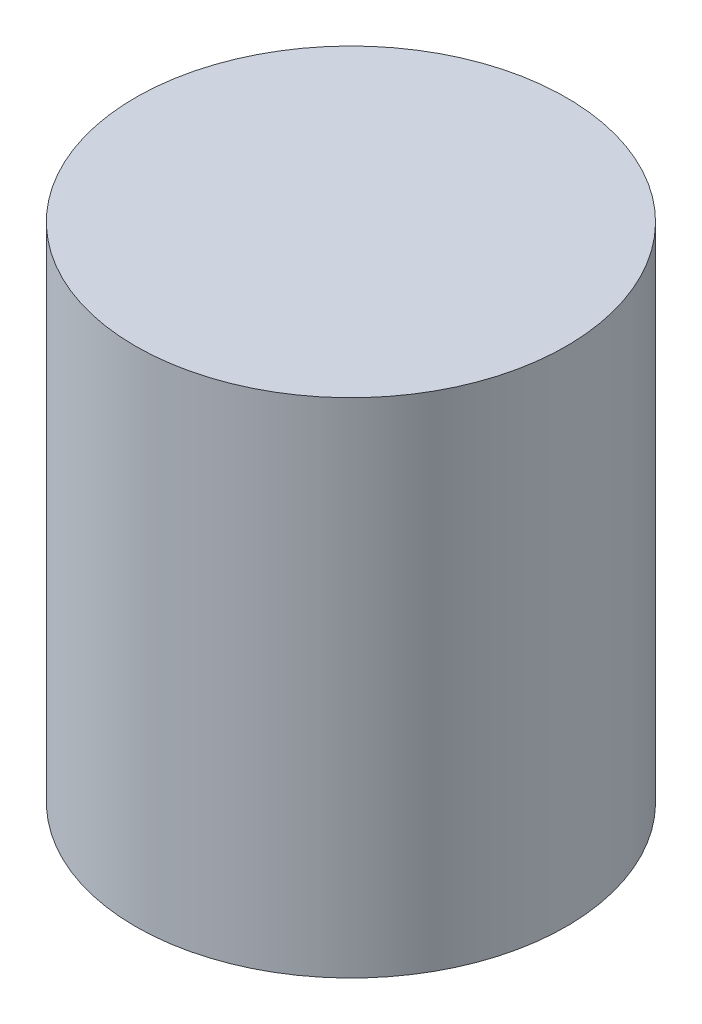
from build123d import *

# Parameters (mm, degrees)
SKETCH1_R           = 3
BOSS_EXTRUDE1_DEPTH = 7


with BuildPart() as part:
    # Sketch1 → Boss-Extrude1 (new body)
    with BuildSketch(Plane(origin=(0, 0, 0), x_dir=(1, 0, 0), z_dir=(0, 1, 0))):
        with Locations(Location((0, 0, 0), (0, 0, 270))):
            Circle(SKETCH1_R)
    extrude(amount=BOSS_EXTRUDE1_DEPTH)


solid = part.part
